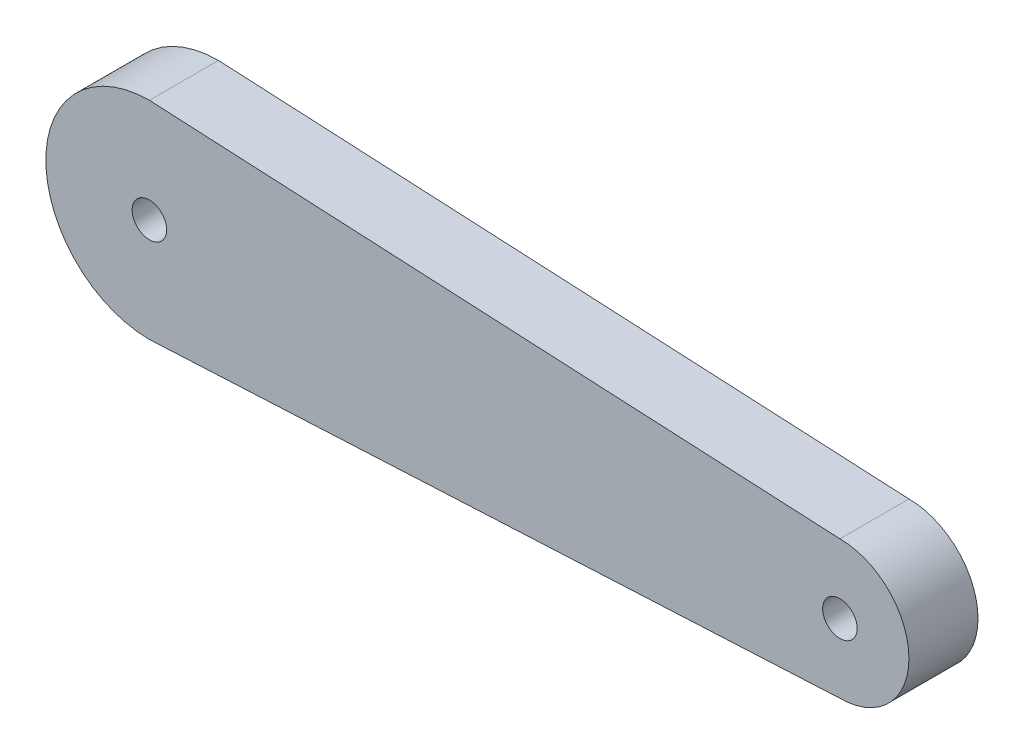
from build123d import *

# Parameters (mm, degrees)
SKETCH1_R           = 10
BOSS_EXTRUDE1_DEPTH = 10
SKETCH9_R           = 2.5
CUT_EXTRUDE7_DEPTH  = 10


with BuildPart() as part:
    # Sketch1 → Boss-Extrude1 (new body)
    with BuildSketch(Plane.XY):
        with BuildLine():
            Line((-36.34910837, 14.107005992), (-37.845367722, 14.18181896))
            ThreePointArc((-37.845367722, 14.18181896), (-52.845367722, -0.81818104), (-37.845367722, -15.81818104))
            Line((-37.845367722, -15.81818104), (-36.34910837, -15.743368072))
            ThreePointArc((-36.34910837, -15.743368072), (-26.722331035, -10.8818809), (-22.845367722, -0.81818104))
            ThreePointArc((-22.845367722, -0.81818104), (-26.722331035, 9.245518819), (-36.34910837, 14.107005992))
        make_face()
        with BuildLine():
            Line((62.154632278, 9.18181896), (-36.34910837, 14.107005992))
            ThreePointArc((-36.34910837, 14.107005992), (-26.722331035, 9.245518819), (-22.845367722, -0.81818104))
            ThreePointArc((-22.845367722, -0.81818104), (-26.722331035, -10.8818809), (-36.34910837, -15.743368072))
            Line((-36.34910837, -15.743368072), (62.154632278, -10.81818104))
            ThreePointArc((62.154632278, -10.81818104), (52.154632278, -0.81818104), (62.154632278, 9.18181896))
        make_face()
        with Locations((62.154632278, -0.81818104)):
            Circle(SKETCH1_R)
    extrude(amount=BOSS_EXTRUDE1_DEPTH)

    # Sketch9 → Cut-Extrude7 (cut)
    with BuildSketch(Plane.XY.offset(10)):
        with Locations((-37.845367722, -0.81818104)):
            Circle(SKETCH9_R)
        with Locations((62.154632278, -0.81818104)):
            Circle(SKETCH9_R)
    extrude(amount=-CUT_EXTRUDE7_DEPTH, mode=Mode.SUBTRACT)


solid = part.part
